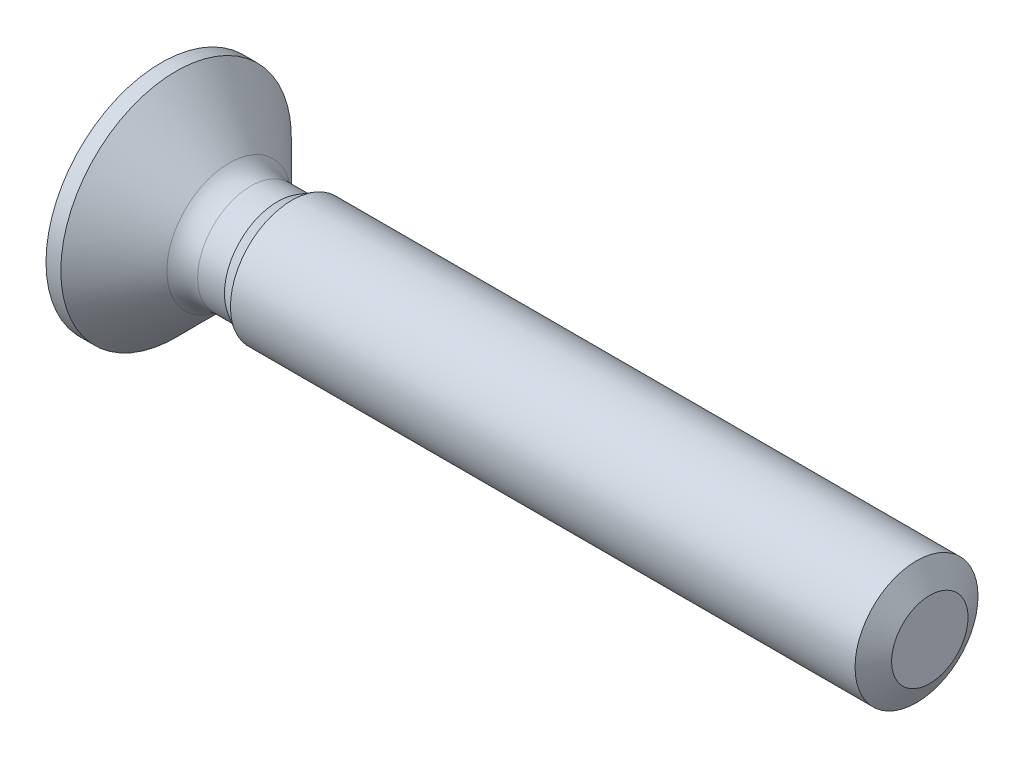
from build123d import *

# Parameters (mm, degrees)
PATTERN_CIRCULAR_1_COUNT = 2
PATTERN_CIRCULAR_1_ANGLE = 90


with BuildPart() as part:
    # 草图1 → Revolve 694 (revolve)
    with BuildSketch(Plane.XY, mode=Mode.PRIVATE) as revolve_694_sk:
        with BuildLine():
            Line((0, 0), (0, 1.5))
            Line((0, 1.5), (0.1928, 1.5))
            Line((0.1928, 1.5), (0.882842712, 0.809957288))
            ThreePointArc((0.882842712, 0.809957288), (1.012612052, 0.723248187), (1.165685425, 0.6928))
            Line((1.165685425, 0.6928), (1.514324153, 0.6928))
            Line((1.514324153, 0.6928), (1.7, 0.8))
            Line((1.7, 0.8), (10, 0.8))
            Line((10, 0.8), (10, 0))
            Line((10, 0), (0, 0))
        make_face()
    revolve(revolve_694_sk.sketch.rotate(Axis((0, 0, 0), (1, 0, 0)), 90), axis=Axis((0, 0, 0), (1, 0, 0)))

    # 草图2 → 切除-旋转1 (revolve, cut)
    with BuildSketch(Plane.XY, mode=Mode.PRIVATE) as cut_revolve_1_sk:
        Polygon((9.826895602, 0.8), (10.176895602, 0.8), (10, 0.4969), align=None)
    revolve(cut_revolve_1_sk.sketch.rotate(Axis((0, 0, 0), (-1, 0, 0)), 270), axis=Axis((0, 0, 0), (-1, 0, 0)), mode=Mode.SUBTRACT)

    # 草图3 → 切除-放样1 section 0
    with BuildSketch(Plane.ZY, mode=Mode.PRIVATE) as loft_1_s0:
        with BuildLine():
            Line((-0.8, 0.175), (0.8, 0.175))
            Line((0.8, 0.175), (0.8, -0.175))
            Line((0.8, -0.175), (-0.8, -0.175))
            Line((-0.8, -0.175), (-0.8, 0.175))
        make_face()
    loft_1 = loft([loft_1_s0.sketch, Vertex(0.9, 0, 0)], mode=Mode.SUBTRACT)

    # 阵列(圆周)1: 切除-放样1 ×2 about axis
    pattern_circular_1_axis = Axis((0, 0, 0), (1, 0, 0))
    for i in range(1, PATTERN_CIRCULAR_1_COUNT):
        add(loft_1.rotate(pattern_circular_1_axis, i * PATTERN_CIRCULAR_1_ANGLE / (PATTERN_CIRCULAR_1_COUNT - 1)), mode=Mode.SUBTRACT)


solid = part.part
